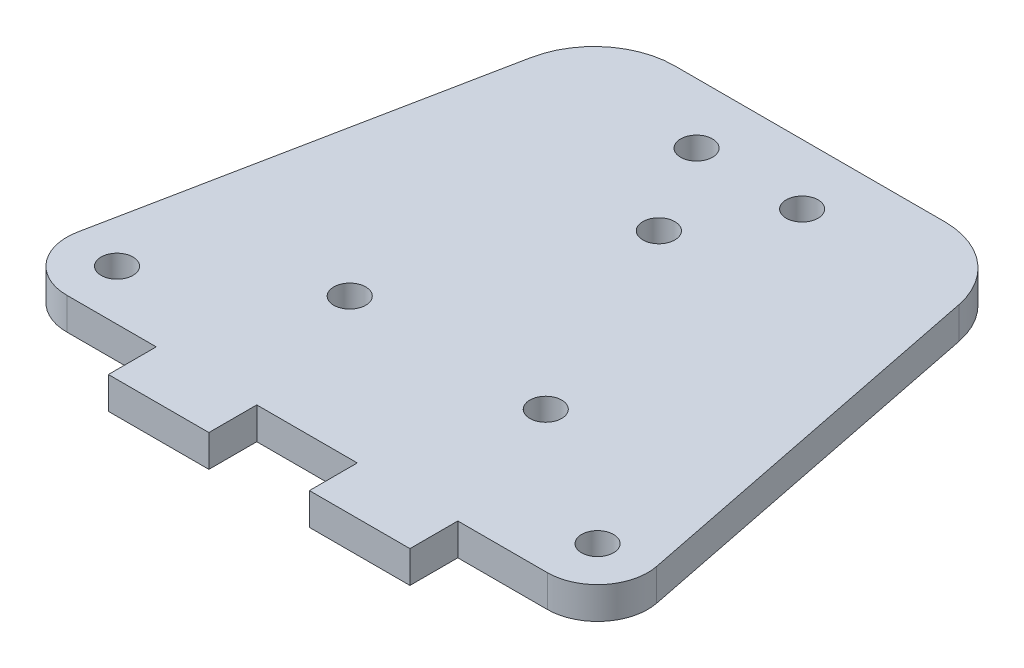
from build123d import *

# Parameters (mm, degrees)
CROQUIS1_R              = 1.5875
SALIENTE_EXTRUIR1_DEPTH = 3.175
CROQUIS2_R              = 1.5875
CORTAR_EXTRUIR1_DEPTH   = 3.175
CROQUIS3_W              = 10
CROQUIS3_H              = 4.7625
SALIENTE_EXTRUIR2_DEPTH = 3.175


with BuildPart() as part:
    # Croquis1 → Saliente-Extruir1 (new body)
    with BuildSketch(Plane(origin=(0, 0, 0), x_dir=(1, 0, 0), z_dir=(0, 1, 0))):
        with BuildLine():
            Line((8.713785816, 43.568929081), (0, 0))
            Line((0, 0), (60, 0))
            Line((60, 0), (51.286214184, 43.568929081))
            ThreePointArc((51.286214184, 43.568929081), (48.513480023, 48.186737131), (43.441568778, 50))
            Line((43.441568778, 50), (16.558431222, 50))
            ThreePointArc((16.558431222, 50), (11.486519977, 48.186737131), (8.713785816, 43.568929081))
        make_face()
        with Locations(Location((39.75, 14, 0), (0, 0, 270))):
            Circle(CROQUIS1_R, mode=Mode.SUBTRACT)
        with Locations(Location((20.25, 14, 0), (0, 0, 270))):
            Circle(CROQUIS1_R, mode=Mode.SUBTRACT)
        with Locations(Location((24.75, 44, 0), (0, 0, 270))):
            Circle(CROQUIS1_R, mode=Mode.SUBTRACT)
        with Locations(Location((35.25, 44, 0), (0, 0, 270))):
            Circle(CROQUIS1_R, mode=Mode.SUBTRACT)
    extrude(amount=SALIENTE_EXTRUIR1_DEPTH)

    # Croquis2 → Cortar-Extruir1 (cut)
    with BuildSketch(Plane(origin=(0, 3.175, 0), x_dir=(1, 0, 0), z_dir=(0, 1, 0))):
        with Locations(Location((30, 35, 0), (0, 0, 270))):
            Circle(CROQUIS2_R)
        with Locations(Location((6.099019514, 5, 0), (0, 0, 270))):
            Circle(CROQUIS2_R)
        with Locations(Location((53.900980486, 5, 0), (0, 0, 270))):
            Circle(CROQUIS2_R)
        with BuildLine():
            Line((53.900980486, 0), (60, 0))
            Line((60, 0), (58.803883865, 5.980580676))
            ThreePointArc((58.803883865, 5.980580676), (57.767691193, 1.830055472), (53.900980486, 0))
        make_face()
        with BuildLine():
            Line((1.196116135, 5.980580676), (0, 0))
            Line((0, 0), (6.099019514, 0))
            ThreePointArc((6.099019514, 0), (2.232308807, 1.830055472), (1.196116135, 5.980580676))
        make_face()
    extrude(amount=-CORTAR_EXTRUIR1_DEPTH, mode=Mode.SUBTRACT)

    # Croquis3 → Saliente-Extruir2 (add)
    with BuildSketch(Plane(origin=(0, 3.175, 0), x_dir=(1, 0, 0), z_dir=(0, 1, 0))):
        with Locations((20, -2.38125)):
            Rectangle(CROQUIS3_W, CROQUIS3_H)
        with Locations((40, -2.38125)):
            Rectangle(CROQUIS3_W, CROQUIS3_H)
    extrude(amount=-SALIENTE_EXTRUIR2_DEPTH)


solid = part.part
